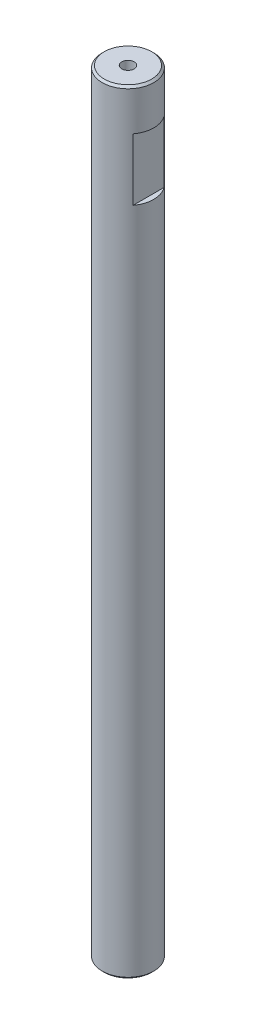
from build123d import *

# Parameters (mm, degrees)
SKETCH_2_R          = 12.5
EXTRUDE_3_DEPTH     = 375
SKETCH_5_R          = 3
CUT_EXTRUDE_2_DEPTH = 20
CUT_EXTRUDE_START   = -50
CUT_EXTRUDE_3_DEPTH = 50
EXTRUDE_START       = -20
SKETCH_11_R         = 12.5
EXTRUDE_5_DEPTH     = 20
CUT_EXTRUDE_START_2 = -20
SKETCH_12_R         = 3
CUT_EXTRUDE_4_DEPTH = 20
CHAMFER_1_SIZE      = 1
CHAMFER_2_SIZE      = 1


with BuildPart() as part:
    # 草图2 → 凸台-拉伸3 (new body)
    with BuildSketch(Plane(origin=(0, 0, 0), x_dir=(1, 0, 0), z_dir=(0, 1, 0))):
        with Locations(Location((0, 0, 0), (0, 0, 270))):
            Circle(SKETCH_2_R)
    extrude(amount=EXTRUDE_3_DEPTH)

    # 草图5 → 切除-拉伸2 (cut)
    with BuildSketch(Plane.XZ):
        with Locations(Location((0, 0, 0), (0, 0, 270))):
            Circle(SKETCH_5_R)
    extrude(amount=-CUT_EXTRUDE_2_DEPTH, mode=Mode.SUBTRACT)

    # 草图7 → 切除-拉伸3 (cut)
    with BuildSketch(Plane(origin=(0, 375, 0), x_dir=(1, 0, 0), z_dir=(0, 1, 0)).offset(CUT_EXTRUDE_START)):
        with BuildLine():
            Line((10, 7.5), (10, 0))
            Line((10, 0), (10, -7.5))
            ThreePointArc((10, -7.5), (11.858541226, -3.952847075), (12.5, 0))
            ThreePointArc((12.5, 0), (11.858541226, 3.952847075), (10, 7.5))
        make_face()
        with BuildLine():
            Line((-10, 0), (-10, 7.5))
            ThreePointArc((-10, 7.5), (-12.5, 0), (-10, -7.5))
            Line((-10, -7.5), (-10, 0))
        make_face()
    extrude(amount=CUT_EXTRUDE_3_DEPTH, mode=Mode.SUBTRACT)

    # 草图11 → 凸台-拉伸5 (add)
    with BuildSketch(Plane(origin=(0, 375, 0), x_dir=(1, 0, 0), z_dir=(0, 1, 0)).offset(EXTRUDE_START)):
        with Locations(Location((0, 0, 0), (0, 0, 270))):
            Circle(SKETCH_11_R)
    extrude(amount=EXTRUDE_5_DEPTH)

    # 草图12 → 切除-拉伸4 (cut)
    with BuildSketch(Plane(origin=(0, 375, 0), x_dir=(1, 0, 0), z_dir=(0, 1, 0)).offset(CUT_EXTRUDE_START_2)):
        with Locations(Location((0, 0, 0), (0, 0, 90))):
            Circle(SKETCH_12_R)
    extrude(amount=CUT_EXTRUDE_4_DEPTH, mode=Mode.SUBTRACT)

    # 倒角1
    chamfer_1_edges = [part.edges().sort_by_distance(p)[0] for p in [
        (0, 0, -12.5),
    ]]
    chamfer(chamfer_1_edges, length=CHAMFER_1_SIZE)

    # 倒角2
    chamfer_2_edges = [part.edges().sort_by_distance(p)[0] for p in [
        (0, 375, -12.5),
    ]]
    chamfer(chamfer_2_edges, length=CHAMFER_2_SIZE)


solid = part.part
